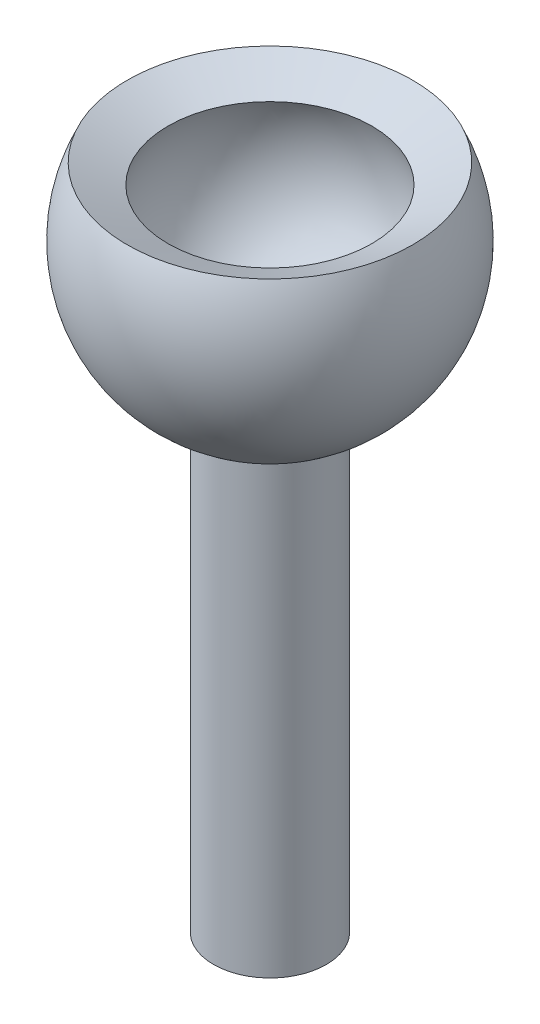
from build123d import *


with BuildPart() as part:
    # Sketch1 → Revolve1 (revolve)
    with BuildSketch(Plane.XY):
        with BuildLine():
            Line((2.5, -6.538348415), (2.5, -26.538348415))
            Line((2.5, -26.538348415), (0, -26.538348415))
            Line((0, -26.538348415), (0, -5))
            ThreePointArc((0, -5), (4.225771274, -2.672612419), (4.517539515, 2.142857143))
            Line((4.517539515, 2.142857143), (6.32455532, 3))
            ThreePointArc((6.32455532, 3), (6.497169905, -2.605145529), (2.5, -6.538348415))
        make_face()
    revolve(axis=Axis((0, 12.862963673, 0), (0, -1, 0)))


solid = part.part
